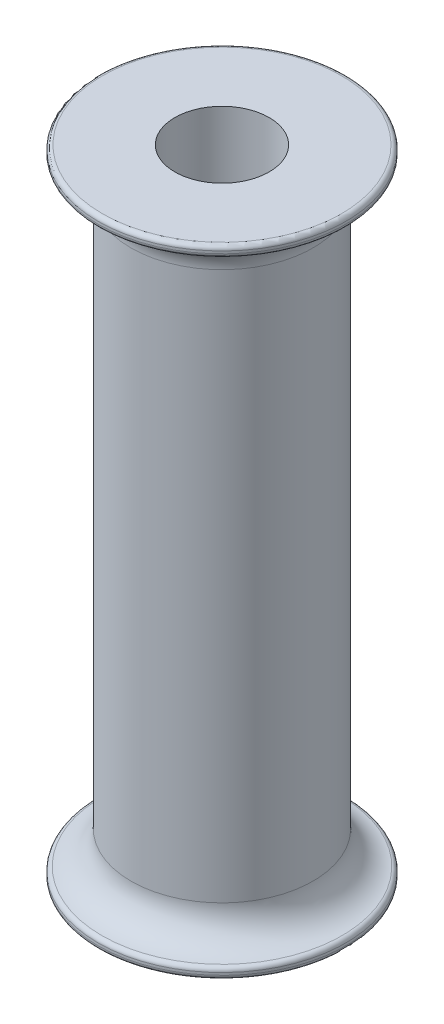
from build123d import *

# Parameters (mm, degrees)
FILLET2_R = 0.2


with BuildPart() as part:
    # Sketch4 → Revolve2 (revolve)
    with BuildSketch(Plane(origin=(0, 0, 0), x_dir=(0, 0, -1), z_dir=(1, 0, 0))):
        with BuildLine():
            Line((2, -12.5), (2, 12.5))
            ThreePointArc((2, 12.5), (2.439339828, 13.560660172), (3.5, 14))
            Line((3.5, 14), (3.5, 14.5))
            Line((3.5, 14.5), (0, 14.5))
            Line((0, 14.5), (0, 14))
            Line((0, 14), (0, -14))
            Line((0, -14), (0, -14.5))
            Line((0, -14.5), (3.5, -14.5))
            Line((3.5, -14.5), (3.5, -14))
            ThreePointArc((3.5, -14), (2.439339828, -13.560660172), (2, -12.5))
        make_face()
    revolve(axis=Axis((0, 0, 2.15), (0, 1, 0)))

    # Fillet2
    fillet2_edges = [part.edges().sort_by_distance(p)[0] for p in [
        (0, -14.5, 7.8),
        (0, -14, 7.8),
        (0, 14, 7.8),
        (0, 14.5, 7.8),
    ]]
    fillet(fillet2_edges, radius=FILLET2_R)


solid = part.part
